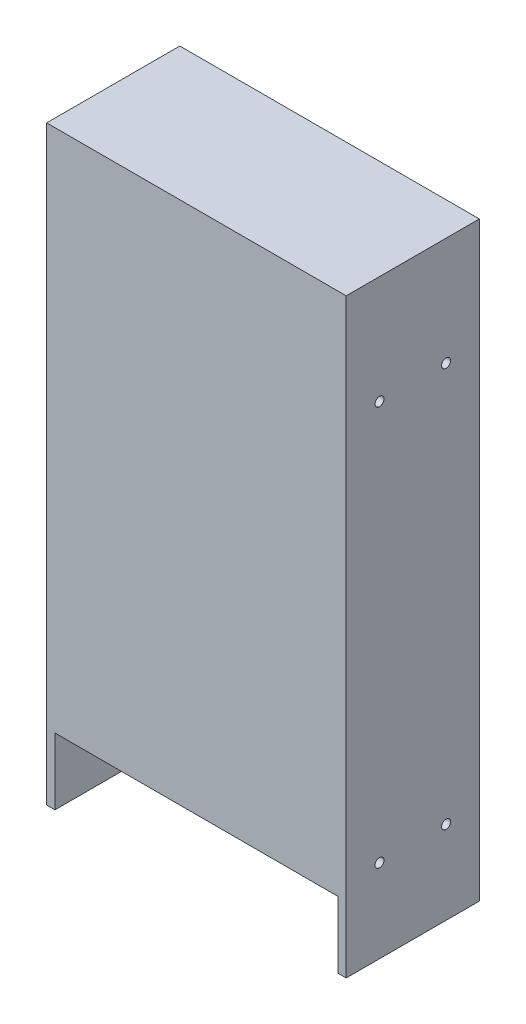
from build123d import *

# Parameters (mm, degrees)
SKETCH1_W           = 114.3
SKETCH1_H           = 225.425
BOSS_EXTRUDE1_DEPTH = 50.8
SKETCH2_W           = 107.95
SKETCH2_H           = 25.4
CUT_EXTRUDE1_DEPTH  = 38.1
SKETCH4_R           = 1.7145
CUT_EXTRUDE2_DEPTH  = 114.3


with BuildPart() as part:
    # Sketch1 → Boss-Extrude1 (new body)
    with BuildSketch(Plane.XY):
        with Locations((3.533467742, -71.539919355)):
            Rectangle(SKETCH1_W, SKETCH1_H)
    extrude(amount=BOSS_EXTRUDE1_DEPTH)

    # Sketch2 → Cut-Extrude1 (cut)
    with BuildSketch(Plane.XY.offset(50.8)):
        with Locations((3.533467742, -171.552419355)):
            Rectangle(SKETCH2_W, SKETCH2_H)
    extrude(amount=-CUT_EXTRUDE1_DEPTH, mode=Mode.SUBTRACT)

    # Sketch4 → Cut-Extrude2 (cut)
    with BuildSketch(Plane(origin=(60.683467742, 0, 0), x_dir=(0, 0, -1), z_dir=(1, 0, 0))):
        with Locations(Location((-12.7, -152.502419355, 0), (0, 0, 90))):
            Circle(SKETCH4_R)
        with Locations(Location((-38.1, -152.502419355, 0), (0, 0, 90))):
            Circle(SKETCH4_R)
        with Locations(Location((-38.1, -0.102419355, 0), (0, 0, 90))):
            Circle(SKETCH4_R)
        with Locations(Location((-12.7, -0.102419355, 0), (0, 0, 90))):
            Circle(SKETCH4_R)
    extrude(amount=-CUT_EXTRUDE2_DEPTH, mode=Mode.SUBTRACT)


solid = part.part
